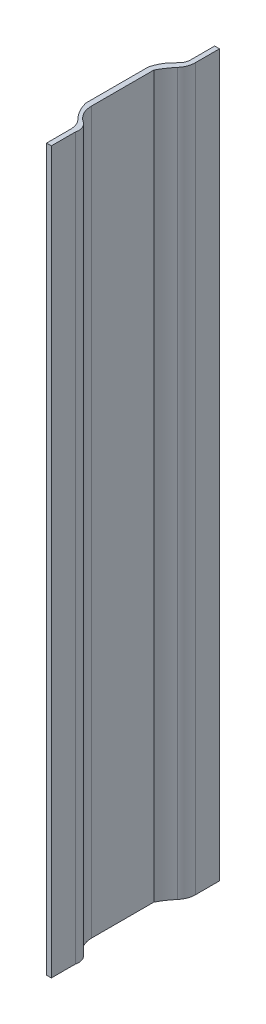
from build123d import *

# Parameters (mm, degrees)
BOSS_EXTRUDE1_DEPTH = 150


with BuildPart() as part:
    # Sketch1 → Boss-Extrude1 (new body)
    with BuildSketch(Plane(origin=(0, 0, 0), x_dir=(1, 0, 0), z_dir=(0, 1, 0))):
        with BuildLine():
            Line((0, 12.157107232), (0, 17.157107232))
            Line((0, 17.157107232), (-1, 17.157107232))
            Line((-1, 17.157107232), (-1, 12.157107232))
            ThreePointArc((-1, 12.157107232), (-1.217641333, 11.133405068), (-1.832917706, 10.286783042))
            ThreePointArc((-1.832917706, 10.286783042), (-3.259534938, 8.562798276), (-4.126843117, 6.5))
            Line((-4.126843117, 6.5), (-4.126843117, -6.5))
            ThreePointArc((-4.126843117, -6.5), (-3.369674027, -8.500338114), (-2.087108773, -10.211970075))
            ThreePointArc((-2.087108773, -10.211970075), (-1.282481997, -11.419555167), (-1, -12.842892768))
            Line((-1, -12.842892768), (-1, -17.842892768))
            Line((-1, -17.842892768), (0, -17.842892768))
            Line((0, -17.842892768), (0, -12.842892768))
            ThreePointArc((0, -12.842892768), (-0.074866398, -11.365840356), (-1, -10.211970075))
            ThreePointArc((-1, -10.211970075), (-2.468183444, -8.608241082), (-3, -6.5))
            Line((-3, -6.5), (-3, 6.5))
            ThreePointArc((-3, 6.5), (-2.087108773, 8.040701214), (-1, 9.463840399))
            ThreePointArc((-1, 9.463840399), (-0.258069079, 10.720645761), (0, 12.157107232))
        make_face()
    extrude(amount=BOSS_EXTRUDE1_DEPTH)


solid = part.part
